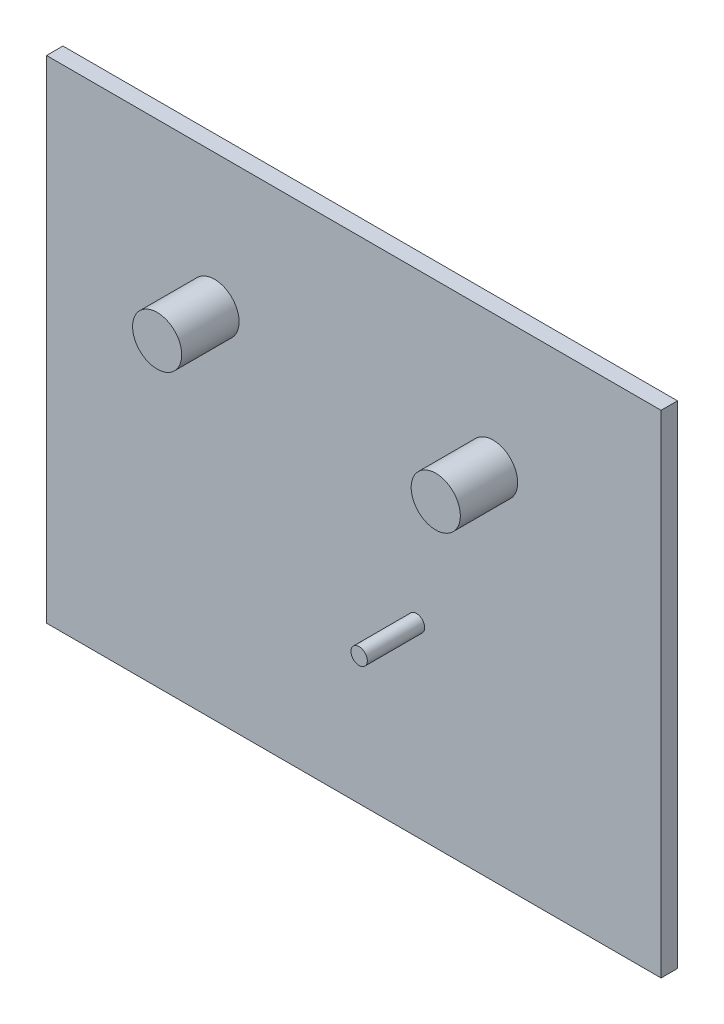
from build123d import *

# Parameters (mm, degrees)
ESQUISSE3_W        = 75
ESQUISSE3_H        = 60
BOSS_EXTRU_4_DEPTH = 2
ESQUISSE7_R        = 3
ESQUISSE7_R_2      = 1
BOSS_EXTRU_5_DEPTH = 7


with BuildPart() as part:
    # Esquisse3 → Boss.-Extru.4 (new body)
    with BuildSketch(Plane.XY):
        Rectangle(ESQUISSE3_W, ESQUISSE3_H)
    extrude(amount=BOSS_EXTRU_4_DEPTH)

    # Esquisse7 → Boss.-Extru.5 (add)
    with BuildSketch(Plane.XY.offset(2)):
        with Locations((-17, 13.6)):
            Circle(ESQUISSE7_R)
        with Locations((17, 13.6)):
            Circle(ESQUISSE7_R)
        with Locations((7.649218941, -7.4)):
            Circle(ESQUISSE7_R_2)
    extrude(amount=BOSS_EXTRU_5_DEPTH)


solid = part.part
